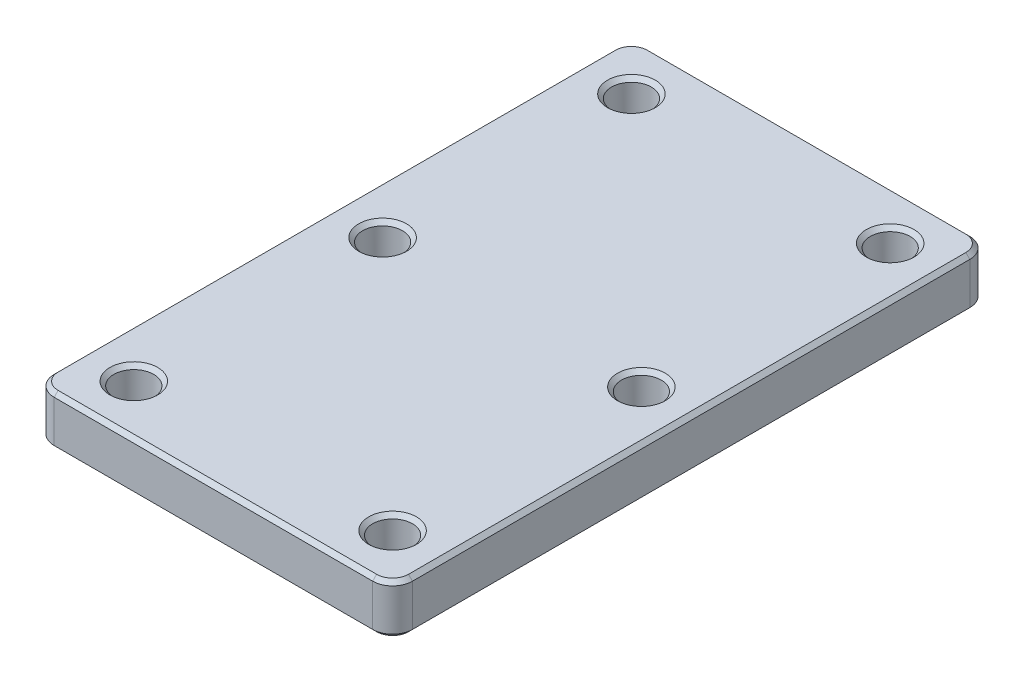
from build123d import *

# Parameters (mm, degrees)
SKETCH1_W           = 180
SKETCH1_H           = 300
BOSS_EXTRUDE1_DEPTH = 25
SKETCH2_R           = 10
CUT_EXTRUDE1_DEPTH  = 351.749198146
FILLET1_R           = 10
CHAMFER2_SIZE       = 2
CHAMFER3_SIZE       = 2


with BuildPart() as part:
    # Sketch1 → Boss-Extrude1 (new body)
    with BuildSketch(Plane(origin=(0, 0, 0), x_dir=(1, 0, 0), z_dir=(0, 1, 0))):
        with Locations((90, 150)):
            Rectangle(SKETCH1_W, SKETCH1_H)
    extrude(amount=BOSS_EXTRUDE1_DEPTH)

    # Sketch2 → Cut-Extrude1 (cut, through all)
    with BuildSketch(Plane(origin=(0, 25, 0), x_dir=(1, 0, 0), z_dir=(0, 1, 0))):
        with Locations(Location((25, 25, 0), (0, 0, 270))):
            Circle(SKETCH2_R)
        with Locations(Location((155, 25, 0), (0, 0, 270))):
            Circle(SKETCH2_R)
        with Locations(Location((155, 150, 0), (0, 0, 270))):
            Circle(SKETCH2_R)
        with Locations(Location((155, 275, 0), (0, 0, 270))):
            Circle(SKETCH2_R)
        with Locations(Location((25, 150, 0), (0, 0, 270))):
            Circle(SKETCH2_R)
        with Locations(Location((25, 275, 0), (0, 0, 270))):
            Circle(SKETCH2_R)
    extrude(amount=-CUT_EXTRUDE1_DEPTH, mode=Mode.SUBTRACT)

    # Fillet1
    fillet1_edges = [part.edges().sort_by_distance(p)[0] for p in [
        (0, 12.5, -300),
        (180, 12.5, -300),
        (180, 12.5, 0),
        (0, 12.5, 0),
    ]]
    fillet(fillet1_edges, radius=FILLET1_R)

    # Chamfer2
    chamfer2_edges = [part.edges().sort_by_distance(p)[0] for p in [
        (90, 0, -300),
        (90, 25, -300),
        (0, 0, -150),
        (180, 0, -150),
        (90, 0, 0),
        (177.071067812, 0, -2.928932188),
        (2.928932188, 0, -2.928932188),
        (2.928932188, 0, -297.071067812),
        (177.071067812, 0, -297.071067812),
        (180, 25, -150),
        (0, 25, -150),
        (90, 25, 0),
        (177.071067812, 25, -2.928932188),
        (2.928932188, 25, -2.928932188),
        (2.928932188, 25, -297.071067812),
        (177.071067812, 25, -297.071067812),
    ]]
    chamfer(chamfer2_edges, length=CHAMFER2_SIZE)

    # Chamfer3
    chamfer3_edges = [part.edges().sort_by_distance(p)[0] for p in [
        (25, 25, -160),
        (155, 25, -285),
        (155, 25, -160),
        (155, 25, -35),
        (25, 25, -285),
        (25, 25, -35),
    ]]
    chamfer(chamfer3_edges, length=CHAMFER3_SIZE)


solid = part.part
